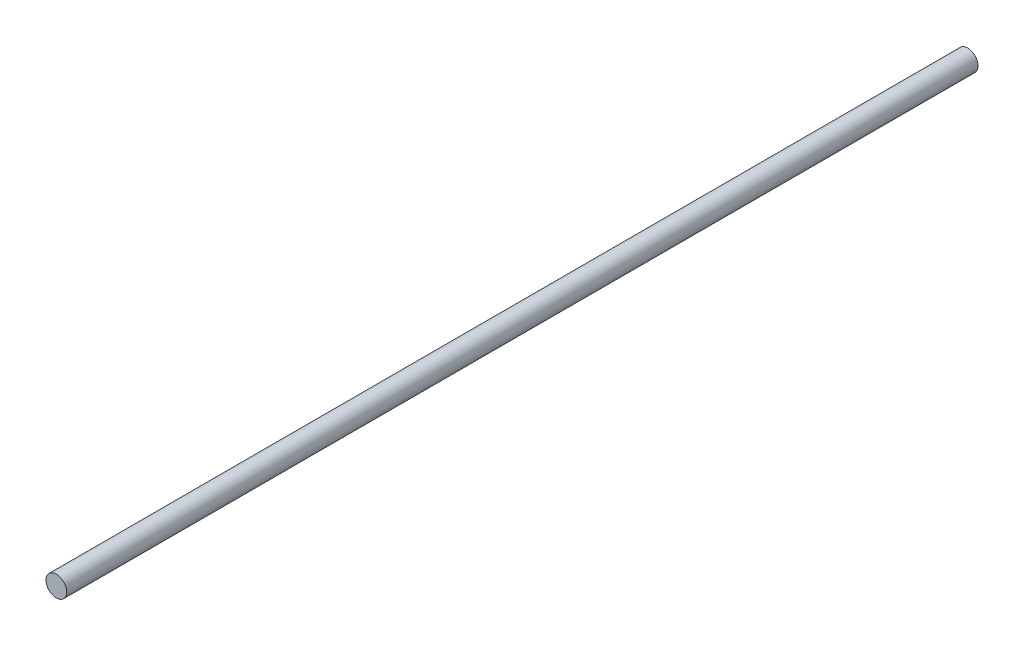
from build123d import *

# Parameters (mm, degrees)
SKETCH1_R           = 3.175
BOSS_EXTRUDE1_DEPTH = 280.035


with BuildPart() as part:
    # Sketch1 → Boss-Extrude1 (new body)
    with BuildSketch(Plane.XY):
        Circle(SKETCH1_R)
    extrude(amount=BOSS_EXTRUDE1_DEPTH)


solid = part.part
